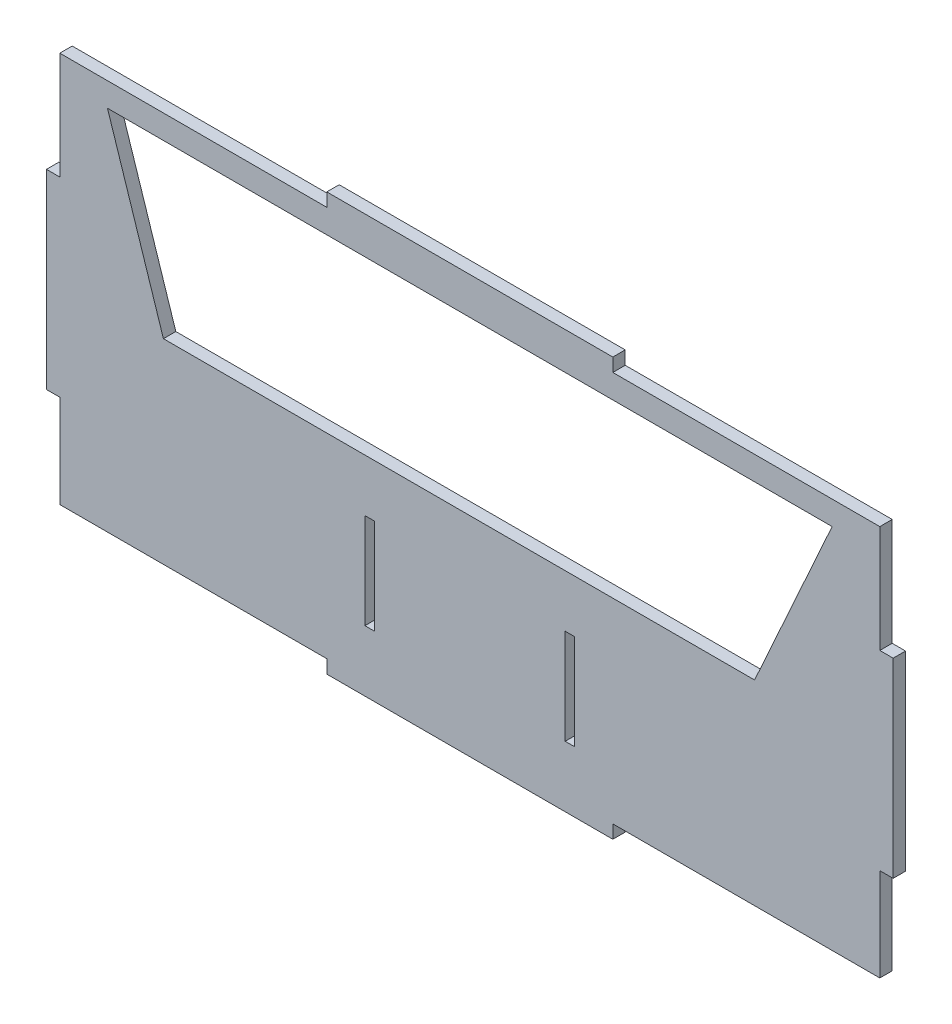
from build123d import *

# Parameters (mm, degrees)
SKETCH1_W           = 86
SKETCH1_H           = 41
BOSS_EXTRUDE1_DEPTH = 1.3
SKETCH2_W           = 1.4
SKETCH2_H           = 20
SKETCH2_W_2         = 30
SKETCH2_H_2         = 1.4
BOSS_EXTRUDE2_DEPTH = 1.3
SKETCH3_W           = 1
SKETCH3_H           = 10
CUT_EXTRUDE1_DEPTH  = 50.524337451


with BuildPart() as part:
    # Sketch1 → Boss-Extrude1 (new body)
    with BuildSketch(Plane.XY):
        Rectangle(SKETCH1_W, SKETCH1_H)
        Polygon((-38, 18), (38, 18), (29.867102397, 0), (-32.132897603, 0), align=None, mode=Mode.SUBTRACT)
    extrude(amount=BOSS_EXTRUDE1_DEPTH)

    # Sketch2 → Boss-Extrude2 (add)
    with BuildSketch(Plane.XY.offset(1.3)):
        with Locations((-43.7, -0.75)):
            Rectangle(SKETCH2_W, SKETCH2_H)
        with Locations((43.7, -0.75)):
            Rectangle(SKETCH2_W, SKETCH2_H)
        with Locations((0, 21.2)):
            Rectangle(SKETCH2_W_2, SKETCH2_H_2)
        with Locations((0, -21.2)):
            Rectangle(SKETCH2_W_2, SKETCH2_H_2)
    extrude(amount=-BOSS_EXTRUDE2_DEPTH)

    # Sketch3 → Cut-Extrude1 (cut, through all)
    with BuildSketch(Plane.XY.offset(1.3)):
        with Locations((-10.5, -10.5)):
            Rectangle(SKETCH3_W, SKETCH3_H)
        with Locations((10.5, -10.5)):
            Rectangle(SKETCH3_W, SKETCH3_H)
    extrude(amount=-CUT_EXTRUDE1_DEPTH, mode=Mode.SUBTRACT)


solid = part.part
